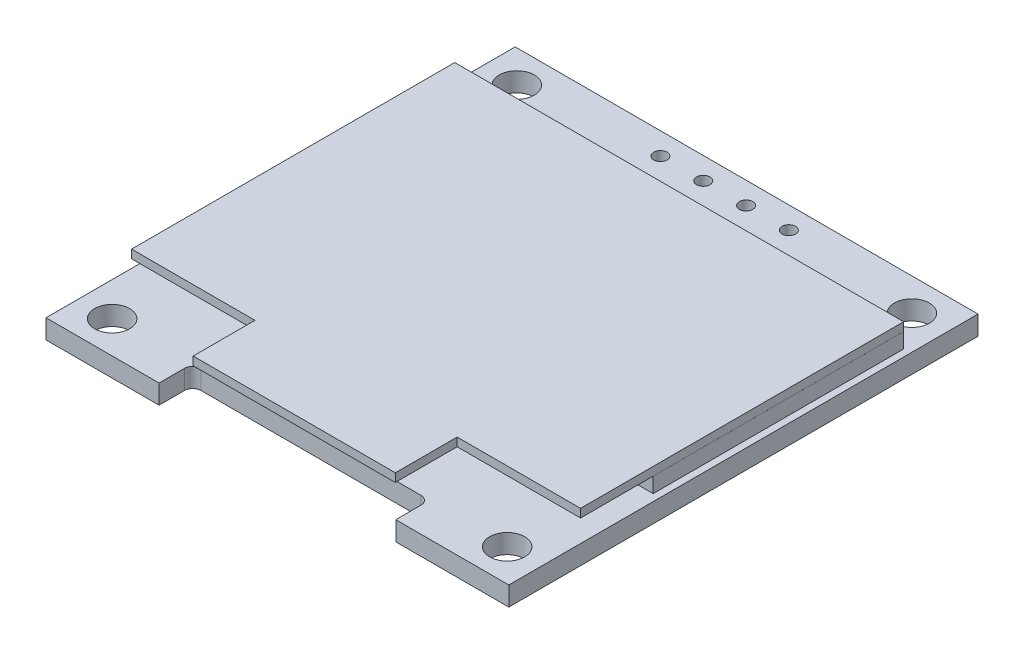
from build123d import *

# Parameters (mm, degrees)
SKETCH1_R          = 1.04
SKETCH1_R_2        = 0.4
PCA_DEPTH          = 1.14
SKETCH2_W          = 26.65
SKETCH2_H          = 14.87
BOTTOM_GLASS_DEPTH = 0.9
TEXT_2_DEPTH       = 0.05
TOP_GLASS_DEPTH    = 0.5
SKETCH4_W          = 23.74
SKETCH4_H          = 3.24
SMD_DEPTH          = 0.8
SKETCH4_W_2        = 14.68
SKETCH4_H_2        = 4
SMD_2_DEPTH        = 0.8


with BuildPart() as part:
    # Sketch1 → PCA (new body)
    with BuildSketch(Plane(origin=(0, 0, 0), x_dir=(1, 0, 0), z_dir=(0, 1, 0))):
        with BuildLine():
            Line((11.124848221, -16.627742616), (17.834848221, -16.627742616))
            Line((17.834848221, -16.627742616), (17.834848221, 11.222257384))
            Line((17.834848221, 11.222257384), (-9.635151779, 11.222257384))
            Line((-9.635151779, 11.222257384), (-9.635151779, -16.627742616))
            Line((-9.635151779, -16.627742616), (-2.925151779, -16.627742616))
            Line((-2.925151779, -16.627742616), (-2.925151779, -15.127742616))
            ThreePointArc((-2.925151779, -15.127742616), (-2.778705169, -14.774189225), (-2.425151779, -14.627742616))
            Line((-2.425151779, -14.627742616), (10.624848221, -14.627742616))
            ThreePointArc((10.624848221, -14.627742616), (10.978401612, -14.774189225), (11.124848221, -15.127742616))
            Line((11.124848221, -15.127742616), (11.124848221, -16.627742616))
        make_face()
        with Locations(Location((-7.625151779, 9.307257384, 0), (0, 0, 270))):
            Circle(SKETCH1_R, mode=Mode.SUBTRACT)
        with Locations(Location((15.824848221, 9.307257384, 0), (0, 0, 270))):
            Circle(SKETCH1_R, mode=Mode.SUBTRACT)
        with Locations(Location((-7.625151779, -14.712742616, 0), (0, 0, 270))):
            Circle(SKETCH1_R, mode=Mode.SUBTRACT)
        with Locations(Location((15.824848221, -14.712742616, 0), (0, 0, 270))):
            Circle(SKETCH1_R, mode=Mode.SUBTRACT)
        with Locations(Location((0.289848221, 9.91843752, 0), (0, 0, 270))):
            Circle(SKETCH1_R_2, mode=Mode.SUBTRACT)
        with Locations(Location((2.829848221, 9.91843752, 0), (0, 0, 270))):
            Circle(SKETCH1_R_2, mode=Mode.SUBTRACT)
        with Locations(Location((5.369848221, 9.91843752, 0), (0, 0, 270))):
            Circle(SKETCH1_R_2, mode=Mode.SUBTRACT)
        with Locations(Location((7.909848221, 9.91843752, 0), (0, 0, 270))):
            Circle(SKETCH1_R_2, mode=Mode.SUBTRACT)
    extrude(amount=PCA_DEPTH)


with BuildPart() as body_2:
    # Sketch2 → Bottom_glass (new body)
    with BuildSketch(Plane(origin=(0, 1.14, 0), x_dir=(1, 0, 0), z_dir=(0, 1, 0))):
        with Locations((4.099848221, -0.212742616)):
            Rectangle(SKETCH2_W, SKETCH2_H)
    extrude(amount=BOTTOM_GLASS_DEPTH)

    # Sketch5 → text 2 (cut)
    # profile 1 of 8: a face of its own
    with BuildSketch(Plane(origin=(0, 2.04, 0), x_dir=(1, 0, 0), z_dir=(0, 1, 0))):
        Polygon((9.164340873, 4.348443866), (9.164340873, 3.393619672), (15.554095686, 3.393619672), (15.554095686, 6.383325683), (9.164340873, 6.383325683), (9.164340873, 5.521229488), (8.46302632, 5.521229488), (8.46302632, 4.348443866), align=None)
        Polygon((9.424087004, 5.321229488), (8.66302632, 5.321229488), (8.66302632, 4.548443866), (9.424087004, 4.548443866), (9.424087004, 3.630016698), (11.313262896, 3.630016698), (11.313262896, 6.149554165), (9.424087004, 6.149554165), align=None, mode=Mode.SUBTRACT)
    # profile 2 of 8: a face of its own
    with BuildSketch(Plane(origin=(0, 2.04, 0), x_dir=(1, 0, 0), z_dir=(0, 1, 0))):
        with BuildLine():
            Line((-6.384535309, 0.190265163), (-7.102484027, 0.190265163))
            add(Edge.make_bspline(
                [(-7.102484027, 0.190265163), (-7.083033625, 0.270796555), (-7.045009681, 0.428228839), (-6.965700942, 0.653159721), (-6.879302644, 0.866013484), (-6.775556119, 1.06280451), (-6.662393252, 1.247487716), (-6.532741317, 1.415874286), (-6.392581952, 1.572246779), (-6.237553496, 1.711019893), (-6.074973698, 1.836683274), (-5.90255171, 1.943826263), (-5.723756524, 2.035995755), (-5.537349363, 2.111927713), (-5.342775257, 2.16912891), (-5.141793261, 2.21063018), (-4.933876689, 2.237581299), (-4.792739339, 2.240211614), (-4.72107377, 2.241547214)],
                knots=[0, 0, 0, 0, 1.162005537, 2.271625781, 3.343758855, 4.383309926, 5.390229558, 6.379919256, 7.361854164, 8.333198761, 9.295911338, 10.242430842, 11.177959212, 12.116337295, 13.062827104, 14.020064771, 14.994644689, 16, 16, 16, 16], degree=3))
            add(Edge.make_bspline(
                [(-4.72107377, 2.241547214), (-4.616656074, 2.238394688), (-4.410098335, 2.232158401), (-4.106639942, 2.175211118), (-3.814007212, 2.08509653), (-3.535403217, 1.960585153), (-3.276618228, 1.807014152), (-3.046364087, 1.62423761), (-2.847761777, 1.415782064), (-2.681146057, 1.185536203), (-2.550688916, 0.939466467), (-2.454491491, 0.686208965), (-2.395927648, 0.426364459), (-2.388337804, 0.250919249), (-2.384535309, 0.163021573)],
                knots=[0, 0, 0, 0, 1.083050992, 2.142477498, 3.193116406, 4.255571735, 5.30263384, 6.308962982, 7.297363603, 8.282367274, 9.249857812, 10.179914175, 11.08814088, 12, 12, 12, 12], degree=3))
            add(Edge.make_bspline(
                [(-2.384535309, 0.163021573), (-2.387194945, 0.078434614), (-2.392399442, -0.087088939), (-2.436590769, -0.328738075), (-2.510959369, -0.556490305), (-2.61397597, -0.77130439), (-2.747328084, -0.971818309), (-2.908865677, -1.158483203), (-3.099728904, -1.332126993), (-3.244366477, -1.431600074), (-3.31883018, -1.48281176)],
                knots=[0, 0, 0, 0, 1.024540389, 2.004866551, 2.965041327, 3.920577974, 4.882998113, 5.874504559, 6.905732034, 8, 8, 8, 8], degree=3))
            add(Edge.make_bspline(
                [(-3.31883018, -1.48281176), (-3.233729027, -1.523904724), (-3.065119029, -1.60532177), (-2.835289247, -1.764992072), (-2.626654103, -1.949349438), (-2.510302746, -2.093218359), (-2.451843001, -2.165504068)],
                knots=[0, 0, 0, 0, 1.015518401, 2.012035669, 3.001164323, 4, 4, 4, 4], degree=3))
            add(Edge.make_bspline(
                [(-2.451843001, -2.165504068), (-2.413348504, -2.2182075), (-2.336989885, -2.322751309), (-2.242737236, -2.490834568), (-2.157230689, -2.66078083), (-2.090601616, -2.837145186), (-2.039004206, -3.017883503), (-2.002121847, -3.203306123), (-1.979209525, -3.39356446), (-1.975928263, -3.5222787), (-1.974278898, -3.586978427)],
                knots=[0, 0, 0, 0, 1.025084078, 2.033381695, 3.024893161, 4.013698104, 4.991890475, 5.976764909, 6.982997093, 8, 8, 8, 8], degree=3))
            add(Edge.make_bspline(
                [(-1.974278898, -3.586978427), (-1.978380644, -3.699000647), (-1.986564831, -3.922517908), (-2.059717001, -4.252745843), (-2.173118694, -4.575546991), (-2.334163119, -4.884289481), (-2.530431711, -5.173158923), (-2.763934166, -5.431619058), (-3.032017385, -5.653787297), (-3.331001725, -5.839410675), (-3.65492659, -5.987794497), (-4.001385086, -6.090782938), (-4.36538521, -6.157859509), (-4.61500189, -6.165052352), (-4.741907103, -6.168709196)],
                knots=[0, 0, 0, 0, 0.955779014, 1.907060117, 2.875433937, 3.871313158, 4.872415639, 5.851225146, 6.836215519, 7.83643374, 8.849228613, 9.86973379, 10.916971861, 12, 12, 12, 12], degree=3))
            add(Edge.make_bspline(
                [(-4.741907103, -6.168709196), (-4.827436933, -6.166724709), (-4.995731116, -6.162819899), (-5.243144826, -6.136125953), (-5.479308711, -6.087371656), (-5.704542077, -6.021764101), (-5.919045017, -5.938582976), (-6.122162972, -5.83499738), (-6.315145586, -5.713142519), (-6.49617176, -5.571580032), (-6.665219915, -5.413222684), (-6.81779757, -5.235259233), (-6.956448525, -5.040979452), (-7.077460271, -4.828126752), (-7.186344734, -4.599451879), (-7.275901206, -4.35202674), (-7.354725363, -4.088063261), (-7.391373282, -3.90411414), (-7.410176334, -3.809734837)],
                knots=[0, 0, 0, 0, 1.048658725, 2.063410685, 3.046034179, 4.001477787, 4.936774919, 5.862367409, 6.792675028, 7.730719943, 8.675894397, 9.627829632, 10.600096036, 11.597688215, 12.626045268, 13.701542398, 14.82072376, 16, 16, 16, 16], degree=3))
            Line((-7.410176334, -3.809734837), (-6.692227616, -3.809734837))
            add(Edge.make_bspline(
                [(-6.692227616, -3.809734837), (-6.67352295, -3.871332582), (-6.63714075, -3.991145545), (-6.575210926, -4.16358053), (-6.504654875, -4.32165608), (-6.428964456, -4.466531787), (-6.349470865, -4.599634422), (-6.260522464, -4.717444408), (-6.168707275, -4.825136299), (-6.099497325, -4.885809697), (-6.065625052, -4.915504068)],
                knots=[0, 0, 0, 0, 1.198163088, 2.33053128, 3.407730985, 4.417276592, 5.372219308, 6.28897303, 7.162600585, 8, 8, 8, 8], degree=3))
            add(Edge.make_bspline(
                [(-6.065625052, -4.915504068), (-6.020832877, -4.950037402), (-5.931386791, -5.018997475), (-5.785630834, -5.107001197), (-5.632339666, -5.18325497), (-5.468191839, -5.241503417), (-5.296729506, -5.290823784), (-5.115181243, -5.323099257), (-4.925148747, -5.345243648), (-4.795393859, -5.347197778), (-4.729086591, -5.348196375)],
                knots=[0, 0, 0, 0, 0.946170439, 1.889420265, 2.845303464, 3.807233317, 4.801018734, 5.828864929, 6.890507805, 8, 8, 8, 8], degree=3))
            add(Edge.make_bspline(
                [(-4.729086591, -5.348196375), (-4.654221442, -5.346788592), (-4.507829106, -5.344035793), (-4.294217999, -5.318719892), (-4.091000976, -5.281850375), (-3.900434288, -5.224906415), (-3.7200217, -5.154550183), (-3.552292215, -5.06621097), (-3.395043973, -4.962565892), (-3.250291046, -4.844762101), (-3.120129886, -4.715798684), (-3.005525284, -4.580911664), (-2.908097487, -4.440669768), (-2.829506451, -4.29429692), (-2.76744805, -4.142399254), (-2.725200734, -3.984550501), (-2.695825843, -3.822042464), (-2.693433586, -3.71157625), (-2.692227616, -3.655888683)],
                knots=[0, 0, 0, 0, 1.217147791, 2.380027433, 3.494444702, 4.572153297, 5.609568379, 6.639424714, 7.649109417, 8.668170816, 9.669597737, 10.625200337, 11.543417969, 12.441394052, 13.322311151, 14.205496177, 15.095365482, 16, 16, 16, 16], degree=3))
            add(Edge.make_bspline(
                [(-2.692227616, -3.655888683), (-2.695725448, -3.58134848), (-2.702703708, -3.432638975), (-2.755980461, -3.213855949), (-2.84361215, -3.003059577), (-2.966292176, -2.803846343), (-3.115630985, -2.619215711), (-3.290179343, -2.454480894), (-3.491386722, -2.318549257), (-3.676574994, -2.224632328), (-3.840609638, -2.160547585), (-3.980987659, -2.117861952), (-4.13814561, -2.081716453), (-4.310182979, -2.048088404), (-4.498396045, -2.019468179), (-4.702579903, -1.995601172), (-4.92277593, -1.976503936), (-5.07521288, -1.967975718), (-5.153766078, -1.963580991)],
                knots=[0, 0, 0, 0, 1.07054697, 2.135767047, 3.216561865, 4.33974944, 5.486079747, 6.621378074, 7.775625952, 8.963672916, 9.598146892, 10.304877434, 11.070270905, 11.915000392, 12.823868403, 13.805723172, 14.86925407, 16, 16, 16, 16], degree=3))
            Line((-5.153766078, -1.963580991), (-5.153766078, -1.14306817))
            add(Edge.make_bspline(
                [(-5.153766078, -1.14306817), (-5.054791985, -1.141388619), (-4.86092605, -1.13809879), (-4.577739067, -1.098309052), (-4.306942925, -1.043267617), (-4.054538944, -0.958958606), (-3.824484742, -0.861037927), (-3.62489708, -0.74709002), (-3.458572172, -0.620427736), (-3.326318294, -0.479096057), (-3.226822914, -0.327518806), (-3.154075949, -0.169537874), (-3.111103775, -0.003768592), (-3.105367393, 0.109362078), (-3.102484027, 0.166226701)],
                knots=[0, 0, 0, 0, 1.321986639, 2.589447074, 3.816329219, 5.01088745, 6.139805852, 7.153945165, 8.075214402, 8.924034688, 9.728124013, 10.488707548, 11.240355623, 12, 12, 12, 12], degree=3))
            add(Edge.make_bspline(
                [(-3.102484027, 0.166226701), (-3.103431252, 0.208004405), (-3.105315711, 0.291119164), (-3.129080917, 0.412547892), (-3.164793011, 0.53026434), (-3.213889535, 0.643767906), (-3.279604275, 0.752271389), (-3.35824653, 0.856699844), (-3.451887902, 0.956457053), (-3.559191781, 1.049440641), (-3.674418764, 1.13805604), (-3.800703964, 1.21328721), (-3.934239677, 1.277618781), (-4.075173746, 1.330669071), (-4.223963529, 1.370576016), (-4.379909947, 1.399229368), (-4.543310366, 1.417144007), (-4.654788611, 1.419723243), (-4.711458386, 1.421034394)],
                knots=[0, 0, 0, 0, 0.884392785, 1.759457502, 2.611959086, 3.489218968, 4.37281399, 5.2945488, 6.255912374, 7.266815255, 8.301784654, 9.332968512, 10.37626691, 11.440494194, 12.520033166, 13.637162961, 14.798855837, 16, 16, 16, 16], degree=3))
            add(Edge.make_bspline(
                [(-4.711458386, 1.421034394), (-4.802547912, 1.417854138), (-4.980466944, 1.411642358), (-5.236958183, 1.35723547), (-5.475402375, 1.270428422), (-5.657662184, 1.166810092), (-5.792250925, 1.064523386), (-5.888426784, 0.975192217), (-5.982873665, 0.875917192), (-6.069378069, 0.760583763), (-6.156861444, 0.637002528), (-6.236506156, 0.498891256), (-6.313899739, 0.34985264), (-6.360534138, 0.24449119), (-6.384535309, 0.190265163)],
                knots=[0, 0, 0, 0, 1.472543308, 2.876219568, 4.221790263, 5.565193594, 6.249813518, 6.953379497, 7.687249741, 8.463570142, 9.283606569, 10.136032583, 11.040678096, 12, 12, 12, 12], degree=3))
        make_face()
    # profile 3 of 8: a face of its own
    with BuildSketch(Plane(origin=(0, 2.04, 0), x_dir=(1, 0, 0), z_dir=(0, 1, 0))):
        with BuildLine():
            Line((2.435977512, 2.241547214), (2.988862127, 1.807252342))
            Line((2.988862127, 1.807252342), (0.875080076, -1.425119452))
            add(Edge.make_bspline(
                [(0.875080076, -1.425119452), (1.015812138, -1.402687771), (1.290325936, -1.35893224), (1.568190847, -1.351714079), (1.703605717, -1.348196375)],
                knots=[0, 0, 0, 0, 1.025318673, 2, 2, 2, 2], degree=3))
            add(Edge.make_bspline(
                [(1.703605717, -1.348196375), (1.78491428, -1.350381774), (1.944967767, -1.354683665), (2.179954743, -1.387789609), (2.405758025, -1.439961294), (2.621441711, -1.516012164), (2.827779955, -1.613160403), (3.02595686, -1.729592106), (3.212247169, -1.871319376), (3.389049864, -2.029639275), (3.549568944, -2.204992382), (3.691685643, -2.39105258), (3.811061167, -2.587626023), (3.907915845, -2.794613145), (3.983126996, -3.011694881), (4.037955899, -3.238593486), (4.070366396, -3.47546542), (4.074767518, -3.636558392), (4.077003153, -3.718388683)],
                knots=[0, 0, 0, 0, 1.04369286, 2.054478336, 3.041073146, 4.015093852, 4.984733326, 5.965804835, 6.960378782, 7.985147595, 9.009457201, 10.008161701, 10.986880575, 11.956520048, 12.937015923, 13.931873656, 14.949455224, 16, 16, 16, 16], degree=3))
            add(Edge.make_bspline(
                [(4.077003153, -3.718388683), (4.073750342, -3.830342292), (4.067349579, -4.0506405), (4.003569474, -4.371501543), (3.904461715, -4.677175864), (3.762798793, -4.962783113), (3.58683906, -5.227931844), (3.372261705, -5.46287005), (3.126676589, -5.672401564), (2.848992479, -5.847616694), (2.550151418, -5.990709382), (2.236203995, -6.093487078), (1.91019909, -6.15676358), (1.688931414, -6.164696386), (1.577003153, -6.168709196)],
                knots=[0, 0, 0, 0, 1.031375318, 2.029502543, 3.004789286, 3.987476834, 4.960371455, 5.9300674, 6.912260825, 7.929083631, 8.949397511, 9.960523116, 10.96833055, 12, 12, 12, 12], degree=3))
            add(Edge.make_bspline(
                [(1.577003153, -6.168709196), (1.469353551, -6.165216154), (1.256118539, -6.15829705), (0.942443581, -6.096660621), (0.641042398, -5.996758672), (0.35402667, -5.859126035), (0.088150984, -5.685279445), (-0.149713328, -5.475994236), (-0.358380242, -5.23574403), (-0.532036518, -4.964566093), (-0.669770762, -4.673160476), (-0.77306202, -4.369304119), (-0.83339629, -4.054104161), (-0.841827277, -3.840432985), (-0.84607377, -3.73281176)],
                knots=[0, 0, 0, 0, 1.012016664, 2.004627821, 2.994792927, 3.992885782, 4.990978636, 5.973936114, 6.964471063, 7.975201453, 8.993600317, 9.990122807, 10.98767138, 12, 12, 12, 12], degree=3))
            add(Edge.make_bspline(
                [(-0.84607377, -3.73281176), (-0.843373324, -3.650424141), (-0.83785953, -3.482204365), (-0.799360352, -3.227429444), (-0.737497964, -2.966741257), (-0.668217401, -2.745588815), (-0.595016007, -2.564419622), (-0.534095916, -2.418354501), (-0.45826964, -2.268043476), (-0.377416197, -2.108332308), (-0.284257639, -1.943337033), (-0.182964726, -1.770300075), (-0.070736953, -1.591973383), (0.007937705, -1.470958079), (0.048156999, -1.409093811)],
                knots=[0, 0, 0, 0, 1.173818275, 2.396712641, 3.66331629, 4.989737886, 5.693666774, 6.447286557, 7.243889047, 8.091586357, 8.998013824, 9.943181721, 10.948533338, 12, 12, 12, 12], degree=3))
            Line((0.048156999, -1.409093811), (2.435977512, 2.241547214))
        make_face()
        with BuildLine():
            add(Edge.make_bspline(
                [(1.552964691, -2.168709196), (1.492022417, -2.170487582), (1.372984453, -2.173961285), (1.198338934, -2.19413329), (1.033051502, -2.232119725), (0.874932339, -2.280499913), (0.72693759, -2.347021192), (0.58799167, -2.427825304), (0.457557266, -2.522959425), (0.337000576, -2.631075793), (0.227698488, -2.74944844), (0.13357019, -2.87623592), (0.052376132, -3.00838267), (-0.013639454, -3.146992823), (-0.065045341, -3.292013394), (-0.102229915, -3.442777392), (-0.122924203, -3.600295806), (-0.126367018, -3.707112955), (-0.128125052, -3.761657914)],
                knots=[0, 0, 0, 0, 1.129588631, 2.206414736, 3.251139165, 4.268635594, 5.265702196, 6.250456724, 7.242448911, 8.251968645, 9.246821453, 10.222880186, 11.173611482, 12.116736599, 13.062300278, 14.020270554, 14.989073742, 16, 16, 16, 16], degree=3))
            add(Edge.make_bspline(
                [(-0.128125052, -3.761657914), (-0.126693369, -3.815715011), (-0.123886051, -3.92171293), (-0.098395034, -4.077916769), (-0.059457703, -4.22823656), (-0.001536798, -4.371897357), (0.067553232, -4.511088941), (0.158765402, -4.640769594), (0.259832341, -4.768815468), (0.380641331, -4.88539026), (0.510294732, -4.993862544), (0.648811767, -5.088674552), (0.793177389, -5.169785805), (0.94534064, -5.233354028), (1.10314266, -5.285523827), (1.267898212, -5.32223578), (1.439721882, -5.342991268), (1.556114883, -5.346438567), (1.615464691, -5.348196375)],
                knots=[0, 0, 0, 0, 0.989467248, 1.94019797, 2.891935182, 3.827694429, 4.772920941, 5.730924762, 6.725747692, 7.756678648, 8.79901574, 9.819492441, 10.826891316, 11.826466727, 12.835195252, 13.867842842, 14.912794438, 16, 16, 16, 16], degree=3))
            add(Edge.make_bspline(
                [(1.615464691, -5.348196375), (1.674814402, -5.346438429), (1.791207213, -5.342990859), (1.963032265, -5.322237331), (2.127782707, -5.285518135), (2.285603298, -5.233374661), (2.437697998, -5.169709267), (2.581937361, -5.089179165), (2.719144432, -4.993279467), (2.848882946, -4.885575631), (2.96918909, -4.76815197), (3.072680014, -4.641912604), (3.161098832, -4.510040843), (3.232948403, -4.372445666), (3.290231354, -4.228149695), (3.329366137, -4.07794004), (3.354804511, -3.921706838), (3.357619063, -3.815712953), (3.359054435, -3.761657914)],
                knots=[0, 0, 0, 0, 1.087397944, 2.132534446, 3.165364764, 4.174271784, 5.174024072, 6.181601208, 7.194203697, 8.236725232, 9.267838612, 10.269026844, 11.221737037, 12.171628256, 13.107553087, 14.05945871, 15.010357665, 16, 16, 16, 16], degree=3))
            add(Edge.make_bspline(
                [(3.359054435, -3.761657914), (3.357796622, -3.707041798), (3.355327945, -3.599848123), (3.327405777, -3.442847853), (3.288680351, -3.291247382), (3.230204853, -3.145999498), (3.154235607, -3.007677379), (3.061702106, -2.875582291), (2.954656231, -2.748701497), (2.831004712, -2.630843649), (2.696398463, -2.5230789), (2.553277125, -2.427948485), (2.403544613, -2.347662824), (2.247352745, -2.280675162), (2.08291187, -2.232333507), (1.912876809, -2.194268951), (1.735072826, -2.174012911), (1.614440578, -2.170499619), (1.552964691, -2.168709196)],
                knots=[0, 0, 0, 0, 0.978206639, 1.919901502, 2.851605144, 3.780102724, 4.718870031, 5.675451981, 6.667674623, 7.690630536, 8.733308323, 9.756129687, 10.767539656, 11.776269907, 12.797430371, 13.836405707, 14.897401972, 16, 16, 16, 16], degree=3))
        make_face(mode=Mode.SUBTRACT)
    # profile 4 of 8: a face of its own
    with BuildSketch(Plane(origin=(0, 2.04, 0), x_dir=(1, 0, 0), z_dir=(0, 1, 0))):
        with BuildLine():
            Line((-7.295979642, 3.972345633), (-7.042373873, 4.124388903))
            add(Edge.make_bspline(
                [(-7.042373873, 4.124388903), (-7.018786812, 4.084905144), (-6.973594915, 4.009255786), (-6.898208035, 3.907034609), (-6.820094111, 3.82015276), (-6.738674683, 3.749115668), (-6.654446727, 3.693188051), (-6.566860395, 3.653586138), (-6.476210843, 3.628886731), (-6.414518996, 3.625886656), (-6.383720027, 3.624388903)],
                knots=[0, 0, 0, 0, 1.272034388, 2.437168799, 3.508375237, 4.49857839, 5.41946034, 6.295179144, 7.148887113, 8, 8, 8, 8], degree=3))
            add(Edge.make_bspline(
                [(-6.383720027, 3.624388903), (-6.357417003, 3.625121479), (-6.305271198, 3.626573814), (-6.228503561, 3.640528787), (-6.15394773, 3.661967754), (-6.083140327, 3.69267141), (-6.017058371, 3.729818683), (-5.959109775, 3.774686836), (-5.909013107, 3.824920726), (-5.868033866, 3.880963002), (-5.836593836, 3.941234843), (-5.812429206, 4.003099944), (-5.799019142, 4.067530146), (-5.796999068, 4.110910543), (-5.795979642, 4.132802364)],
                knots=[0, 0, 0, 0, 1.095163259, 2.171163733, 3.241058638, 4.321873601, 5.38011039, 6.391990106, 7.366004449, 8.327778327, 9.272591725, 10.192022065, 11.087607919, 12, 12, 12, 12], degree=3))
            add(Edge.make_bspline(
                [(-5.795979642, 4.132802364), (-5.797243337, 4.157780235), (-5.799812244, 4.208556597), (-5.821524941, 4.283470586), (-5.855681438, 4.357607074), (-5.887192276, 4.403465302), (-5.903551757, 4.427273518)],
                knots=[0, 0, 0, 0, 0.938893495, 1.908633276, 2.914225137, 4, 4, 4, 4], degree=3))
            add(Edge.make_bspline(
                [(-5.903551757, 4.427273518), (-5.916983712, 4.44445651), (-5.945182422, 4.480530051), (-5.99366029, 4.534225967), (-6.050545531, 4.589613184), (-6.113891435, 4.648806661), (-6.186005511, 4.709053344), (-6.264629095, 4.773226154), (-6.351769545, 4.838884648), (-6.412883399, 4.882918276), (-6.444417142, 4.905638903)],
                knots=[0, 0, 0, 0, 0.722233717, 1.516239348, 2.393582979, 3.351407094, 4.387010283, 5.505090956, 6.712668013, 8, 8, 8, 8], degree=3))
            add(Edge.make_bspline(
                [(-6.444417142, 4.905638903), (-6.475980567, 4.928120549), (-6.536327433, 4.971103745), (-6.620720503, 5.034895989), (-6.696187186, 5.093219306), (-6.762392057, 5.146622744), (-6.819305998, 5.195113549), (-6.867377493, 5.238226068), (-6.90538197, 5.277126263), (-6.926515325, 5.302361699), (-6.93600368, 5.313691787)],
                knots=[0, 0, 0, 0, 1.452282411, 2.77665338, 3.964542531, 5.026858415, 5.96415736, 6.766646006, 7.446254459, 8, 8, 8, 8], degree=3))
            add(Edge.make_bspline(
                [(-6.93600368, 5.313691787), (-6.949265862, 5.331349819), (-6.975347722, 5.366076708), (-7.009775727, 5.420355157), (-7.039037866, 5.475917956), (-7.061977008, 5.532914412), (-7.081293767, 5.590544351), (-7.094286279, 5.649559704), (-7.102421762, 5.709695663), (-7.103254894, 5.750164378), (-7.10367195, 5.770422556)],
                knots=[0, 0, 0, 0, 1.068054152, 2.10047183, 3.106115577, 4.101338837, 5.06977816, 6.043150881, 7.020423561, 8, 8, 8, 8], degree=3))
            add(Edge.make_bspline(
                [(-7.10367195, 5.770422556), (-7.102553199, 5.802162363), (-7.10033961, 5.864963561), (-7.081619167, 5.956704273), (-7.052070973, 6.04429263), (-7.010675354, 6.126861488), (-6.957311909, 6.2022609), (-6.895558217, 6.271358174), (-6.822005514, 6.329445531), (-6.741303266, 6.380198723), (-6.652969232, 6.419923802), (-6.560405601, 6.449890357), (-6.463465254, 6.46686972), (-6.397805424, 6.469306376), (-6.364489257, 6.470542749)],
                knots=[0, 0, 0, 0, 1.005424448, 1.989358655, 2.955360095, 3.929531133, 4.905563448, 5.876582895, 6.856512386, 7.866279853, 8.892233794, 9.918561126, 10.94386622, 12, 12, 12, 12], degree=3))
            add(Edge.make_bspline(
                [(-6.364489257, 6.470542749), (-6.329137171, 6.469323419), (-6.258833156, 6.466898561), (-6.155419542, 6.445814962), (-6.055853214, 6.410928672), (-5.975758987, 6.371338394), (-5.913073763, 6.331797181), (-5.865268563, 6.295780188), (-5.816825034, 6.25431581), (-5.767352416, 6.207293599), (-5.717688993, 6.154282098), (-5.667097463, 6.095644364), (-5.615459518, 6.031738745), (-5.582240209, 5.986117744), (-5.565210411, 5.962730249)],
                knots=[0, 0, 0, 0, 1.286793592, 2.559021753, 3.825965368, 5.121522368, 5.803751409, 6.523245864, 7.299691795, 8.125521123, 9.008227632, 9.944561021, 10.946284179, 12, 12, 12, 12], degree=3))
            Line((-5.565210411, 5.962730249), (-5.808599834, 5.778235056))
            add(Edge.make_bspline(
                [(-5.808599834, 5.778235056), (-5.823296348, 5.79716822), (-5.851598397, 5.833629065), (-5.894566528, 5.884690193), (-5.935065369, 5.93133289), (-5.974965712, 5.971845857), (-6.012160253, 6.008447685), (-6.048260575, 6.03978462), (-6.082747162, 6.066163701), (-6.1262188, 6.094315324), (-6.180833987, 6.122220899), (-6.249392161, 6.145834394), (-6.321037539, 6.160024447), (-6.369834366, 6.161900637), (-6.394537334, 6.162850441)],
                knots=[0, 0, 0, 0, 1.181633172, 2.275549214, 3.290209073, 4.226197932, 5.078386478, 5.862611352, 6.581680152, 7.217281963, 8.414376989, 9.595101626, 10.782541182, 12, 12, 12, 12], degree=3))
            add(Edge.make_bspline(
                [(-6.394537334, 6.162850441), (-6.425528639, 6.161811841), (-6.485292451, 6.159808999), (-6.570141225, 6.137934726), (-6.646507447, 6.103493131), (-6.712123931, 6.05522315), (-6.766755625, 5.998033728), (-6.80627459, 5.932223281), (-6.830060445, 5.85955265), (-6.832962971, 5.808859801), (-6.83444118, 5.783042749)],
                knots=[0, 0, 0, 0, 1.14458467, 2.207223713, 3.21896685, 4.227309161, 5.202851033, 6.127160689, 7.046193047, 8, 8, 8, 8], degree=3))
            add(Edge.make_bspline(
                [(-6.83444118, 5.783042749), (-6.834104215, 5.766970053), (-6.833429732, 5.734798379), (-6.824022763, 5.687268589), (-6.811937624, 5.639858869), (-6.792786797, 5.59278237), (-6.766347965, 5.545215776), (-6.731629243, 5.496340001), (-6.687903547, 5.445724251), (-6.654408965, 5.412803645), (-6.636724834, 5.395422556)],
                knots=[0, 0, 0, 0, 0.858281714, 1.717966888, 2.583508476, 3.4729293, 4.427298488, 5.488583878, 6.674047936, 8, 8, 8, 8], degree=3))
            add(Edge.make_bspline(
                [(-6.636724834, 5.395422556), (-6.630157944, 5.389562249), (-6.614556515, 5.375639499), (-6.586034293, 5.352846115), (-6.548369037, 5.324729453), (-6.502544293, 5.289940325), (-6.447715126, 5.249584786), (-6.383875506, 5.204178833), (-6.31173705, 5.152248439), (-6.260546836, 5.115941976), (-6.233479642, 5.096744672)],
                knots=[0, 0, 0, 0, 0.420754252, 0.999615792, 1.744751191, 2.668019286, 3.750313428, 4.999500688, 6.413464383, 8, 8, 8, 8], degree=3))
            add(Edge.make_bspline(
                [(-6.233479642, 5.096744672), (-6.200920288, 5.073052078), (-6.137873611, 5.027174654), (-6.048167114, 4.958246928), (-5.966829564, 4.890834555), (-5.893575389, 4.825368034), (-5.827680897, 4.762343955), (-5.769877136, 4.701004086), (-5.719575124, 4.641787881), (-5.665421508, 4.56586853), (-5.610086235, 4.472627601), (-5.562564942, 4.358389111), (-5.532600645, 4.24370655), (-5.528682203, 4.166626405), (-5.526748873, 4.128595633)],
                knots=[0, 0, 0, 0, 1.163667725, 2.253281268, 3.268753668, 4.215851969, 5.092017293, 5.902905408, 6.650798638, 7.335211899, 8.59617414, 9.77448103, 10.901945474, 12, 12, 12, 12], degree=3))
            add(Edge.make_bspline(
                [(-5.526748873, 4.128595633), (-5.527312134, 4.101699892), (-5.528427718, 4.048430706), (-5.541251359, 3.970212069), (-5.560039643, 3.894242752), (-5.588357272, 3.821461798), (-5.622919979, 3.750537716), (-5.666776763, 3.683330944), (-5.717611922, 3.618354031), (-5.775926577, 3.55733961), (-5.839737351, 3.501328585), (-5.907180517, 3.451503675), (-5.978366466, 3.409959398), (-6.052909023, 3.376058676), (-6.130825311, 3.349544232), (-6.212089126, 3.330333202), (-6.296834421, 3.318542592), (-6.354434834, 3.317318797), (-6.383720027, 3.316696595)],
                knots=[0, 0, 0, 0, 0.983748083, 1.948392443, 2.894712957, 3.844097841, 4.80183111, 5.778335162, 6.776009319, 7.81870978, 8.863265674, 9.881300176, 10.883814829, 11.87499822, 12.874611388, 13.892143829, 14.928324115, 16, 16, 16, 16], degree=3))
            add(Edge.make_bspline(
                [(-6.383720027, 3.316696595), (-6.406378892, 3.317134751), (-6.451411258, 3.318005544), (-6.518019385, 3.325703784), (-6.58328189, 3.336595587), (-6.646379846, 3.353887647), (-6.708126199, 3.374867913), (-6.7682524, 3.40070077), (-6.826787589, 3.431658371), (-6.884059803, 3.467054106), (-6.939923381, 3.508246459), (-6.993854354, 3.556223742), (-7.047622227, 3.609662746), (-7.099639995, 3.670014657), (-7.150959833, 3.736304443), (-7.200569898, 3.809152314), (-7.249497085, 3.888161474), (-7.280196057, 3.943760119), (-7.295979642, 3.972345633)],
                knots=[0, 0, 0, 0, 0.915332311, 1.819136955, 2.706846663, 3.586547465, 4.459518054, 5.340707479, 6.227863349, 7.133153174, 8.059268498, 9.028702269, 10.047606654, 11.120612155, 12.245963614, 13.433783089, 14.680604001, 16, 16, 16, 16], degree=3))
        make_face()
    # profile 5 of 8: a face of its own
    with BuildSketch(Plane(origin=(0, 2.04, 0), x_dir=(1, 0, 0), z_dir=(0, 1, 0))):
        with BuildLine():
            Line((-4.988287334, 6.470542749), (-4.719056565, 6.470542749))
            Line((-4.719056565, 6.470542749), (-4.719056565, 5.171864864))
            add(Edge.make_bspline(
                [(-4.719056565, 5.171864864), (-4.690156021, 5.207988277), (-4.63388518, 5.278322414), (-4.539174223, 5.370089149), (-4.441913476, 5.449630824), (-4.338743639, 5.512948359), (-4.231557478, 5.562968253), (-4.119902926, 5.598443379), (-4.003759236, 5.620258605), (-3.924880536, 5.623000106), (-3.88492195, 5.624388903)],
                knots=[0, 0, 0, 0, 1.125788106, 2.19196713, 3.20547328, 4.180437432, 5.132270164, 6.079753143, 7.027236121, 8, 8, 8, 8], degree=3))
            add(Edge.make_bspline(
                [(-3.88492195, 5.624388903), (-3.844353042, 5.62289282), (-3.764949903, 5.619964624), (-3.64933722, 5.596810297), (-3.541370756, 5.557246779), (-3.441371462, 5.503103615), (-3.351521722, 5.435669763), (-3.27193621, 5.357814172), (-3.206929811, 5.267579385), (-3.162701996, 5.184216882), (-3.133924789, 5.110040807), (-3.115708938, 5.046409511), (-3.100263911, 4.975505014), (-3.086806995, 4.897363814), (-3.07783821, 4.81161081), (-3.070634252, 4.718632878), (-3.065511577, 4.618435348), (-3.065313059, 4.549075134), (-3.065210411, 4.513211018)],
                knots=[0, 0, 0, 0, 1.235656852, 2.418478516, 3.575258207, 4.727955599, 5.870717718, 6.98870536, 8.107142894, 9.245821548, 9.854588956, 10.528768408, 11.260415777, 12.065282286, 12.943670737, 13.886611085, 14.907229059, 16, 16, 16, 16], degree=3))
            Line((-3.065210411, 4.513211018), (-3.065210411, 3.393619672))
            Line((-3.065210411, 3.393619672), (-3.33444118, 3.393619672))
            Line((-3.33444118, 3.393619672), (-3.33444118, 4.424869672))
            add(Edge.make_bspline(
                [(-3.33444118, 4.424869672), (-3.334604297, 4.454717674), (-3.334916312, 4.511811823), (-3.335947751, 4.593554202), (-3.338250221, 4.667693746), (-3.341970929, 4.733992847), (-3.345884049, 4.792543936), (-3.35126975, 4.843261982), (-3.357535665, 4.886216647), (-3.363166049, 4.912072043), (-3.36569118, 4.923667749)],
                knots=[0, 0, 0, 0, 1.430932559, 2.737130458, 3.918967929, 4.986496826, 5.920444988, 6.731744033, 7.431208747, 8, 8, 8, 8], degree=3))
            add(Edge.make_bspline(
                [(-3.36569118, 4.923667749), (-3.375483391, 4.957691403), (-3.394308857, 5.023101681), (-3.438064266, 5.111955175), (-3.492714847, 5.187713525), (-3.559441072, 5.249354343), (-3.637062526, 5.297707091), (-3.726085353, 5.331193761), (-3.825671697, 5.351977523), (-3.895830102, 5.354068355), (-3.932397911, 5.355158133)],
                knots=[0, 0, 0, 0, 1.090059168, 2.095632401, 3.037101401, 3.955032261, 4.878929692, 5.839099886, 6.873700383, 8, 8, 8, 8], degree=3))
            add(Edge.make_bspline(
                [(-3.932397911, 5.355158133), (-3.954056002, 5.354750282), (-3.996916806, 5.353943155), (-4.060472805, 5.345839814), (-4.122126288, 5.332598055), (-4.182471012, 5.314679879), (-4.240228038, 5.290297991), (-4.297080888, 5.262072114), (-4.351418782, 5.227522181), (-4.404206625, 5.188757238), (-4.453335939, 5.145840301), (-4.499044895, 5.100542911), (-4.539792044, 5.052307227), (-4.576707979, 5.001907128), (-4.608575081, 4.948651305), (-4.636392008, 4.893053317), (-4.659994034, 4.83504005), (-4.671722056, 4.794775711), (-4.677590219, 4.774629287)],
                knots=[0, 0, 0, 0, 1.024319606, 2.027102035, 3.025350316, 4.005802111, 5.00026367, 5.987881639, 7.005602596, 8.042517216, 9.083927026, 10.089214625, 11.084353441, 12.06828073, 13.041928858, 14.016821737, 15.00770877, 16, 16, 16, 16], degree=3))
            add(Edge.make_bspline(
                [(-4.677590219, 4.774629287), (-4.680966871, 4.760039901), (-4.688325011, 4.728247832), (-4.696309154, 4.675812697), (-4.703455837, 4.614881521), (-4.709497451, 4.545546721), (-4.713202953, 4.467554227), (-4.717195731, 4.381436262), (-4.718682029, 4.286653388), (-4.718927988, 4.220742953), (-4.719056565, 4.186287941)],
                knots=[0, 0, 0, 0, 0.607992626, 1.324890765, 2.152360218, 3.099583803, 4.150613268, 5.323148443, 6.60066238, 8, 8, 8, 8], degree=3))
            Line((-4.719056565, 4.186287941), (-4.719056565, 3.393619672))
            Line((-4.719056565, 3.393619672), (-4.988287334, 3.393619672))
            Line((-4.988287334, 3.393619672), (-4.988287334, 6.470542749))
        make_face()
    # profile 6 of 8: a face of its own
    with BuildSketch(Plane(origin=(0, 2.04, 0), x_dir=(1, 0, 0), z_dir=(0, 1, 0))):
        with BuildLine():
            add(Edge.make_bspline(
                [(-1.390931565, 5.624388903), (-1.349796188, 5.623512996), (-1.269139768, 5.621795557), (-1.151018723, 5.603439872), (-1.038265749, 5.575370703), (-0.930449013, 5.536566507), (-0.828949331, 5.484553406), (-0.732288265, 5.422488299), (-0.640730828, 5.348960362), (-0.585853946, 5.292082018), (-0.557998873, 5.263211018)],
                knots=[0, 0, 0, 0, 1.054011418, 2.066658804, 3.057071809, 4.030435133, 4.997543892, 5.974964718, 6.972108034, 8, 8, 8, 8], degree=3))
            add(Edge.make_bspline(
                [(-0.557998873, 5.263211018), (-0.534014341, 5.23559903), (-0.486509443, 5.180909423), (-0.42559597, 5.092233183), (-0.373120347, 5.000398811), (-0.331066381, 4.904186817), (-0.297907789, 4.804437099), (-0.274365763, 4.700806803), (-0.260362676, 4.593524791), (-0.258474419, 4.520664359), (-0.257518104, 4.483763903)],
                knots=[0, 0, 0, 0, 1.025258237, 2.030674902, 3.01204498, 3.988269485, 4.97094183, 5.956517959, 6.965070386, 8, 8, 8, 8], degree=3))
            add(Edge.make_bspline(
                [(-0.257518104, 4.483763903), (-0.25835925, 4.446649567), (-0.260021394, 4.37330991), (-0.275744494, 4.265293311), (-0.30019971, 4.160554892), (-0.335198429, 4.059533154), (-0.380076808, 3.961919302), (-0.434840255, 3.868139688), (-0.499873069, 3.778009288), (-0.573590781, 3.692293427), (-0.655063817, 3.613293814), (-0.743449087, 3.544441012), (-0.837009688, 3.485451134), (-0.936989705, 3.437934206), (-1.042476122, 3.400468749), (-1.153696466, 3.374154449), (-1.270477955, 3.358244434), (-1.350215573, 3.356201372), (-1.390931565, 3.355158133)],
                knots=[0, 0, 0, 0, 0.998656419, 1.973391657, 2.932242238, 3.890759089, 4.846373663, 5.82037756, 6.809684879, 7.83454468, 8.860553229, 9.859544525, 10.845671541, 11.83227036, 12.833544569, 13.85385346, 14.904124723, 16, 16, 16, 16], degree=3))
            add(Edge.make_bspline(
                [(-1.390931565, 3.355158133), (-1.431847039, 3.356204873), (-1.511982062, 3.358254965), (-1.62917576, 3.374092636), (-1.740595434, 3.400456621), (-1.846219947, 3.438057329), (-1.946629816, 3.485452653), (-2.040732527, 3.544262672), (-2.129189598, 3.613314234), (-2.21067987, 3.692287894), (-2.28439296, 3.778010714), (-2.349426967, 3.868139318), (-2.404190104, 3.961919398), (-2.449068565, 4.059533128), (-2.484067261, 4.160554899), (-2.508522484, 4.265293309), (-2.524245582, 4.373309911), (-2.525907726, 4.446649568), (-2.526748873, 4.483763903)],
                knots=[0, 0, 0, 0, 1.099876186, 2.154163076, 3.173186993, 4.173200201, 5.163417411, 6.152872554, 7.150605724, 8.17532212, 9.198891216, 10.186952605, 11.159729845, 12.11414092, 13.071450619, 14.029093627, 15.002601286, 16, 16, 16, 16], degree=3))
            add(Edge.make_bspline(
                [(-2.526748873, 4.483763903), (-2.525786035, 4.520463799), (-2.523879783, 4.593123287), (-2.509890775, 4.700203625), (-2.486440584, 4.803658529), (-2.453242244, 4.903023223), (-2.410800652, 4.998813597), (-2.359062405, 5.090874881), (-2.297527577, 5.179150138), (-2.250211618, 5.233769064), (-2.226268104, 5.261408133)],
                knots=[0, 0, 0, 0, 1.031353054, 2.041901799, 3.029428768, 4.008703097, 4.981709435, 5.96992636, 6.972712378, 8, 8, 8, 8], degree=3))
            add(Edge.make_bspline(
                [(-2.226268104, 5.261408133), (-2.198455025, 5.29052951), (-2.143755714, 5.347801821), (-2.051742518, 5.421115413), (-1.955319243, 5.484472048), (-1.852697878, 5.535451661), (-1.744969714, 5.575598962), (-1.631638935, 5.603512261), (-1.513117064, 5.621729422), (-1.43206596, 5.623493574), (-1.390931565, 5.624388903)],
                knots=[0, 0, 0, 0, 1.027980169, 2.021703884, 2.998553061, 3.971491411, 4.943284454, 5.930300938, 6.949603206, 8, 8, 8, 8], degree=3))
        make_face()
        with BuildLine():
            add(Edge.make_bspline(
                [(-1.392133488, 5.355158133), (-1.421222869, 5.354331341), (-1.478650694, 5.352699098), (-1.563181766, 5.340284323), (-1.644559041, 5.320615034), (-1.722936908, 5.2926687), (-1.798051055, 5.256583929), (-1.8699734, 5.212262478), (-1.938915492, 5.160291372), (-2.003528689, 5.100751939), (-2.062827814, 5.035712801), (-2.114666079, 4.966414208), (-2.158744742, 4.893980197), (-2.195464878, 4.818335444), (-2.222813896, 4.738713375), (-2.242676487, 4.656015691), (-2.25507955, 4.570073906), (-2.256696446, 4.511650176), (-2.257518104, 4.481961018)],
                knots=[0, 0, 0, 0, 1.021534396, 2.016698045, 2.994645724, 3.958388632, 4.93408049, 5.916473867, 6.921342795, 7.962252576, 8.998418191, 10.008913653, 10.997312074, 11.973003931, 12.956656626, 13.948281152, 14.957379055, 16, 16, 16, 16], degree=3))
            add(Edge.make_bspline(
                [(-2.257518104, 4.481961018), (-2.256140826, 4.443602138), (-2.253407188, 4.367466933), (-2.231176985, 4.255343113), (-2.193988745, 4.147701526), (-2.143771077, 4.045173195), (-2.080851461, 3.950311242), (-2.00671969, 3.865735684), (-1.922171375, 3.792719275), (-1.828214375, 3.732135693), (-1.726767817, 3.683998759), (-1.619405256, 3.649885351), (-1.507427518, 3.627709615), (-1.430901177, 3.625505494), (-1.392133488, 3.624388903)],
                knots=[0, 0, 0, 0, 1.016792936, 2.018143844, 3.017858371, 4.030088057, 5.03801393, 6.028138512, 7.003788237, 7.991172063, 8.984598303, 9.972568034, 10.972917682, 12, 12, 12, 12], degree=3))
            add(Edge.make_bspline(
                [(-1.392133488, 3.624388903), (-1.353368029, 3.625512), (-1.27684609, 3.627728963), (-1.165023938, 3.649773666), (-1.057954819, 3.684148232), (-0.95661363, 3.732081555), (-0.862699398, 3.792949339), (-0.777543009, 3.865323376), (-0.704044199, 3.950535249), (-0.641186824, 4.045298845), (-0.590146758, 4.147542575), (-0.553132585, 4.25536298), (-0.53084894, 4.367461873), (-0.528122516, 4.443600442), (-0.526748873, 4.481961018)],
                knots=[0, 0, 0, 0, 1.02726834, 2.027799167, 3.010890988, 4.004497153, 4.992059811, 5.971914811, 6.958719428, 7.966827853, 8.981595046, 9.981490638, 10.983022906, 12, 12, 12, 12], degree=3))
            add(Edge.make_bspline(
                [(-0.526748873, 4.481961018), (-0.527570247, 4.511650353), (-0.529186586, 4.570074432), (-0.541593699, 4.656013678), (-0.561441304, 4.738720761), (-0.588845547, 4.818308192), (-0.625406131, 4.894176053), (-0.67033481, 4.966201534), (-0.721961404, 5.035952859), (-0.781976079, 5.100541694), (-0.846521831, 5.160314582), (-0.915491864, 5.21228263), (-0.98730756, 5.256389141), (-1.062203488, 5.292977347), (-1.140591403, 5.320360782), (-1.221854657, 5.340397894), (-1.306025065, 5.352646634), (-1.363247102, 5.354315613), (-1.392133488, 5.355158133)],
                knots=[0, 0, 0, 0, 1.042956736, 2.052379634, 3.044323526, 4.02829302, 5.004299113, 5.996692471, 7.007513377, 8.048758398, 9.090003419, 10.095195979, 11.07790575, 12.047570684, 13.018257071, 13.989683339, 14.985167495, 16, 16, 16, 16], degree=3))
        make_face(mode=Mode.SUBTRACT)
    # profile 7 of 8: a face of its own
    with BuildSketch(Plane(origin=(0, 2.04, 0), x_dir=(1, 0, 0), z_dir=(0, 1, 0))):
        Polygon((0.550174204, 6.470542749), (0.819404973, 6.470542749), (0.819404973, 5.585927364), (1.204020358, 5.585927364), (1.204020358, 5.316696595), (0.819404973, 5.316696595), (0.819404973, 3.393619672), (0.550174204, 3.393619672), (0.550174204, 5.316696595), (0.16555882, 5.316696595), (0.16555882, 5.585927364), (0.550174204, 5.585927364), align=None)
    # profile 8 of 8: a face of its own
    with BuildSketch(Plane(origin=(0, 2.04, 0), x_dir=(1, 0, 0), z_dir=(0, 1, 0))):
        with BuildLine():
            Line((2.704020358, 5.312489864), (2.52132805, 5.124388903))
            add(Edge.make_bspline(
                [(2.52132805, 5.124388903), (2.505564762, 5.142657314), (2.475174997, 5.17787666), (2.426976584, 5.224965574), (2.378956353, 5.264511522), (2.331771655, 5.297899172), (2.284235996, 5.323141298), (2.236907209, 5.341565465), (2.18973629, 5.352967013), (2.158205403, 5.354436532), (2.142722281, 5.355158133)],
                knots=[0, 0, 0, 0, 1.26578478, 2.440284043, 3.530471711, 4.527705817, 5.468200915, 6.346673037, 7.188140097, 8, 8, 8, 8], degree=3))
            add(Edge.make_bspline(
                [(2.142722281, 5.355158133), (2.123745661, 5.354236814), (2.086402359, 5.352423787), (2.032894515, 5.334326561), (1.98322255, 5.306547642), (1.940230853, 5.267145999), (1.903812842, 5.221919483), (1.877229687, 5.171351205), (1.860973129, 5.116967167), (1.85891193, 5.079227289), (1.857866512, 5.060086018)],
                knots=[0, 0, 0, 0, 0.99966794, 1.967205029, 2.953328237, 3.988086729, 5.028030931, 6.008226631, 6.989793394, 8, 8, 8, 8], degree=3))
            add(Edge.make_bspline(
                [(1.857866512, 5.060086018), (1.858818637, 5.042761409), (1.860720202, 5.008161028), (1.87550307, 4.957119856), (1.899045418, 4.907356681), (1.921048441, 4.876874189), (1.932385743, 4.861167749)],
                knots=[0, 0, 0, 0, 0.960159726, 1.917612774, 2.927026955, 4, 4, 4, 4], degree=3))
            add(Edge.make_bspline(
                [(1.932385743, 4.861167749), (1.939211594, 4.852780962), (1.95373956, 4.834930744), (1.981004001, 4.810156013), (2.011880432, 4.78277694), (2.049011807, 4.755402509), (2.090798403, 4.726575316), (2.138146361, 4.69743063), (2.189553079, 4.665746837), (2.226356485, 4.645651607), (2.245486704, 4.63520621)],
                knots=[0, 0, 0, 0, 0.66740084, 1.420478572, 2.27185888, 3.217733974, 4.268547843, 5.408967954, 6.65319498, 8, 8, 8, 8], degree=3))
            add(Edge.make_bspline(
                [(2.245486704, 4.63520621), (2.268812627, 4.622139151), (2.31387063, 4.596897894), (2.377893002, 4.557718149), (2.43599618, 4.518776928), (2.488672467, 4.480490693), (2.534908303, 4.441788235), (2.576106491, 4.404153015), (2.611239443, 4.366447893), (2.630914237, 4.340105225), (2.640318435, 4.327513903)],
                knots=[0, 0, 0, 0, 1.27191281, 2.456916733, 3.569705269, 4.599008579, 5.553216877, 6.436649441, 7.252746552, 8, 8, 8, 8], degree=3))
            add(Edge.make_bspline(
                [(2.640318435, 4.327513903), (2.655927458, 4.302085827), (2.686992312, 4.251479238), (2.719613683, 4.168149157), (2.73852249, 4.079768726), (2.741147251, 4.019312538), (2.742481896, 3.988571595)],
                knots=[0, 0, 0, 0, 0.995354457, 1.980940102, 2.973342416, 4, 4, 4, 4], degree=3))
            add(Edge.make_bspline(
                [(2.742481896, 3.988571595), (2.741865153, 3.966912327), (2.740649793, 3.924230373), (2.732200022, 3.861371947), (2.717667185, 3.801256612), (2.697872538, 3.743232082), (2.671143076, 3.688410134), (2.639816393, 3.635407635), (2.602209326, 3.585371123), (2.559273861, 3.5383663), (2.512263437, 3.495435659), (2.462115319, 3.457700842), (2.40876775, 3.42635141), (2.35260192, 3.400409685), (2.293490216, 3.37977975), (2.231423397, 3.36549758), (2.16659875, 3.356949499), (2.122516057, 3.355762805), (2.100054012, 3.355158133)],
                knots=[0, 0, 0, 0, 1.032770009, 2.035186124, 3.017557409, 3.978232242, 4.952395191, 5.920591857, 6.910227898, 7.931268572, 8.952309245, 9.941945286, 10.918353717, 11.897095711, 12.887975737, 13.898235213, 14.929059601, 16, 16, 16, 16], degree=3))
            add(Edge.make_bspline(
                [(2.100054012, 3.355158133), (2.06973929, 3.356009019), (2.009531067, 3.357698968), (1.920482736, 3.373561307), (1.833464943, 3.398243073), (1.749136194, 3.432285302), (1.669382382, 3.475271627), (1.596413018, 3.526753679), (1.529974622, 3.58503082), (1.492158959, 3.629699029), (1.473251127, 3.652033133)],
                knots=[0, 0, 0, 0, 1.013940152, 2.01379169, 3.017749504, 4.037548394, 5.051665909, 6.043208538, 7.021604269, 8, 8, 8, 8], degree=3))
            Line((1.473251127, 3.652033133), (1.651736704, 3.855158133))
            add(Edge.make_bspline(
                [(1.651736704, 3.855158133), (1.668684487, 3.83685405), (1.701540326, 3.801368815), (1.754084226, 3.75411938), (1.807552284, 3.714518291), (1.861410587, 3.681395364), (1.916456382, 3.65587359), (1.972381194, 3.637943366), (2.029071272, 3.626419773), (2.067147388, 3.62506696), (2.086231896, 3.624388903)],
                knots=[0, 0, 0, 0, 1.179806542, 2.287233372, 3.337373186, 4.324005949, 5.273901747, 6.200048787, 7.097828587, 8, 8, 8, 8], degree=3))
            add(Edge.make_bspline(
                [(2.086231896, 3.624388903), (2.11221869, 3.625563895), (2.162992526, 3.627859634), (2.235715747, 3.648702856), (2.302863142, 3.681385672), (2.361168866, 3.727743984), (2.41079929, 3.781705904), (2.446737725, 3.842489435), (2.469260161, 3.908310683), (2.471905303, 3.953938371), (2.473251127, 3.977153326)],
                knots=[0, 0, 0, 0, 1.072336372, 2.095165389, 3.102688358, 4.141489647, 5.156069229, 6.117746104, 7.042326257, 8, 8, 8, 8], degree=3))
            add(Edge.make_bspline(
                [(2.473251127, 3.977153326), (2.472320018, 3.996275856), (2.470481667, 4.034030732), (2.456044577, 4.088673882), (2.43323356, 4.140504694), (2.410772433, 4.170838677), (2.399332858, 4.186287941)],
                knots=[0, 0, 0, 0, 1.013901739, 2.00181326, 2.98231254, 4, 4, 4, 4], degree=3))
            add(Edge.make_bspline(
                [(2.399332858, 4.186287941), (2.39245652, 4.194032537), (2.377477372, 4.210903065), (2.350001451, 4.235267418), (2.317102712, 4.261528646), (2.278411144, 4.289241436), (2.233848748, 4.318040241), (2.183234912, 4.347773971), (2.12726301, 4.379854879), (2.087688183, 4.401128869), (2.067001127, 4.41224948)],
                knots=[0, 0, 0, 0, 0.615000592, 1.339693406, 2.178160186, 3.116406724, 4.166410947, 5.330106347, 6.604359322, 8, 8, 8, 8], degree=3))
            add(Edge.make_bspline(
                [(2.067001127, 4.41224948), (2.044675436, 4.424711592), (2.001378795, 4.448879606), (1.940052546, 4.486521961), (1.884726242, 4.524808196), (1.834068607, 4.56159063), (1.789359173, 4.598808582), (1.750774075, 4.636503369), (1.716794175, 4.673154786), (1.697982108, 4.699123897), (1.68899632, 4.711528326)],
                knots=[0, 0, 0, 0, 1.262093308, 2.447601706, 3.550203992, 4.582594899, 5.537233252, 6.418365656, 7.244515135, 8, 8, 8, 8], degree=3))
            add(Edge.make_bspline(
                [(1.68899632, 4.711528326), (1.673455806, 4.736510281), (1.642369347, 4.786482923), (1.612184897, 4.869891903), (1.591436872, 4.957701952), (1.589583395, 5.018290685), (1.588635743, 5.04926871)],
                knots=[0, 0, 0, 0, 0.985009483, 1.970363186, 2.962279964, 4, 4, 4, 4], degree=3))
            add(Edge.make_bspline(
                [(1.588635743, 5.04926871), (1.589093624, 5.069519051), (1.589989764, 5.109151838), (1.597141808, 5.167385113), (1.610163275, 5.222712102), (1.626496065, 5.275963698), (1.649195784, 5.32610835), (1.676320845, 5.373814754), (1.708195781, 5.41901697), (1.744918601, 5.461019654), (1.785295726, 5.499170505), (1.828919814, 5.532426472), (1.874809749, 5.560803348), (1.923159822, 5.584602057), (1.974434514, 5.602603242), (2.028275416, 5.614995286), (2.084573549, 5.623271174), (2.123060228, 5.624010961), (2.142722281, 5.624388903)],
                knots=[0, 0, 0, 0, 1.087655834, 2.128696564, 3.144119009, 4.137814668, 5.115653402, 6.093965665, 7.082169637, 8.081268856, 9.086088321, 10.061021666, 11.022561449, 11.980240094, 12.950172527, 13.934149372, 14.944599409, 16, 16, 16, 16], degree=3))
            add(Edge.make_bspline(
                [(2.142722281, 5.624388903), (2.166029764, 5.623442325), (2.213081954, 5.621531413), (2.283671634, 5.606355106), (2.354157355, 5.581383874), (2.424720227, 5.546895674), (2.494843332, 5.502266923), (2.565143495, 5.448327524), (2.636464664, 5.38543234), (2.680998646, 5.33734729), (2.704020358, 5.312489864)],
                knots=[0, 0, 0, 0, 0.845714091, 1.707292901, 2.609013841, 3.555613372, 4.552488639, 5.621697636, 6.770543573, 8, 8, 8, 8], degree=3))
        make_face()
    extrude(amount=-TEXT_2_DEPTH, mode=Mode.SUBTRACT)

    # Sketch3 → Top_glass (add)
    with BuildSketch(Plane(origin=(0, 2.04, 0), x_dir=(1, 0, 0), z_dir=(0, 1, 0))):
        Polygon((-9.225151779, 7.222257384), (17.424135021, 7.222257384), (17.424135021, -11.957742616), (10.099848221, -11.957742616), (10.099848221, -15.627742616), (-1.900151779, -15.627742616), (-1.900151779, -11.957742616), (-9.225151779, -11.957742616), align=None)
    extrude(amount=TOP_GLASS_DEPTH)


with BuildPart() as body_3:
    # Sketch4 → SMD (new body)
    with BuildSketch(Plane.XZ):
        with Locations((3.764848221, 2.897742616)):
            Rectangle(SKETCH4_W, SKETCH4_H)
    extrude(amount=SMD_DEPTH)


with BuildPart() as body_4:
    # Sketch4 → SMD 2 (new body)
    with BuildSketch(Plane.XZ):
        with Locations((5.694848221, -3.922257384)):
            Rectangle(SKETCH4_W_2, SKETCH4_H_2)
    extrude(amount=SMD_2_DEPTH)


solid = Compound([part.part, body_2.part, body_3.part, body_4.part])
